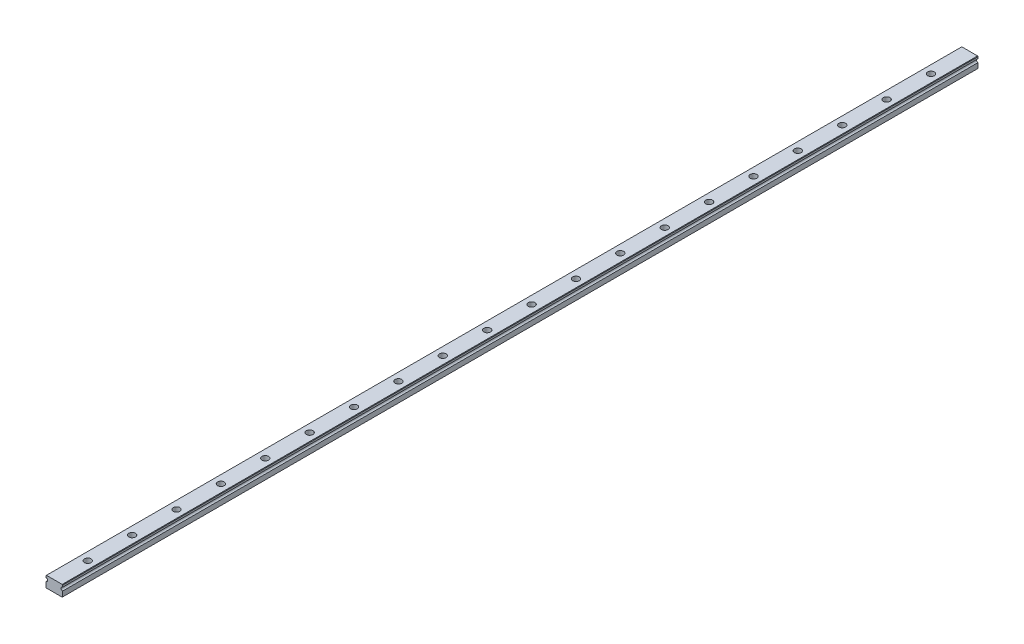
from build123d import *

# Parameters (mm, degrees)
EXTRUDE_1_DEPTH        = 1000
SKETCH_2_R             = 1.5
CUT_EXTRUDE_1_DEPTH    = 20
SKETCH_3_R             = 3
CUT_EXTRUDE_2_DEPTH    = 4.5
PATTERN_LINEAR_1_COUNT = 25
PATTERN_LINEAR_1_PITCH = 40
CUT_EXTRUDE_4_DEPTH    = 80
CUT_EXTRUDE_5_DEPTH    = 80
EXTRUDE_START          = 15
EXTRUDE_2_DEPTH        = 15
CUT_EXTRUDE_START      = -30
CUT_EXTRUDE_8_DEPTH    = 30


with BuildPart() as part:
    # 草图1 → 凸台-拉伸1 (new body)
    with BuildSketch(Plane.XY):
        with BuildLine():
            Line((-7.643186957, 0.234233912), (-7.643186957, -4.365766088))
            Line((-7.643186957, -4.365766088), (-7.243186957, -4.765766088))
            Line((-7.243186957, -4.765766088), (6.956813043, -4.765766088))
            Line((6.956813043, -4.765766088), (7.356813043, -4.365766088))
            Line((7.356813043, -4.365766088), (7.356813043, 0.234233912))
            ThreePointArc((7.356813043, 0.234233912), (6.296152871, 0.67357374), (5.856813043, 1.734233912))
            ThreePointArc((5.856813043, 1.734233912), (6.296152871, 2.794894084), (7.356813043, 3.234233912))
            Line((7.356813043, 3.234233912), (7.356813043, 4.834233912))
            Line((7.356813043, 4.834233912), (6.956813043, 5.234233912))
            Line((6.956813043, 5.234233912), (-7.243186957, 5.234233912))
            Line((-7.243186957, 5.234233912), (-7.643186957, 4.834233912))
            Line((-7.643186957, 4.834233912), (-7.643186957, 3.234233912))
            ThreePointArc((-7.643186957, 3.234233912), (-6.143186957, 1.734233912), (-7.643186957, 0.234233912))
        make_face()
    extrude(amount=EXTRUDE_1_DEPTH)

    # 草图2 → 切除-拉伸1 (cut)
    with BuildSketch(Plane(origin=(0, 5.234233912, 0), x_dir=(1, 0, 0), z_dir=(0, 1, 0))):
        with Locations(Location((0, -20, 0), (0, 0, 270))):
            Circle(SKETCH_2_R)
    cut_extrude_1 = extrude(amount=-CUT_EXTRUDE_1_DEPTH, mode=Mode.SUBTRACT)

    # 草图3 → 切除-拉伸2 (cut)
    with BuildSketch(Plane(origin=(0, 5.234233912, 0), x_dir=(1, 0, 0), z_dir=(0, 1, 0))):
        with Locations(Location((0, -20, 0), (0, 0, 270))):
            Circle(SKETCH_3_R)
    cut_extrude_2 = extrude(amount=-CUT_EXTRUDE_2_DEPTH, mode=Mode.SUBTRACT)

    # 阵列(线性)1: 切除-拉伸1, 切除-拉伸2 ×25
    with Locations(*[(0, 0, i * PATTERN_LINEAR_1_PITCH) for i in range(1, PATTERN_LINEAR_1_COUNT)]):
        add(cut_extrude_1, mode=Mode.SUBTRACT)
        add(cut_extrude_2, mode=Mode.SUBTRACT)

    # 草图6 → 切除-拉伸4 (cut)
    with BuildSketch(Plane(origin=(0, 0, 0), x_dir=(-1, 0, 0), z_dir=(0, 0, -1))):
        with BuildLine():
            Line((7.643186957, 3.234233912), (7.643186957, 4.834233912))
            Line((7.643186957, 4.834233912), (7.243186957, 5.234233912))
            Line((7.243186957, 5.234233912), (-6.956813043, 5.234233912))
            Line((-6.956813043, 5.234233912), (-7.356813043, 4.834233912))
            Line((-7.356813043, 4.834233912), (-7.356813043, 3.234233912))
            ThreePointArc((-7.356813043, 3.234233912), (-5.856813043, 1.734233912), (-7.356813043, 0.234233912))
            Line((-7.356813043, 0.234233912), (-7.356813043, -4.365766088))
            Line((-7.356813043, -4.365766088), (-6.956813043, -4.765766088))
            Line((-6.956813043, -4.765766088), (7.243186957, -4.765766088))
            Line((7.243186957, -4.765766088), (7.643186957, -4.365766088))
            Line((7.643186957, -4.365766088), (7.643186957, 0.234233912))
            ThreePointArc((7.643186957, 0.234233912), (6.143186957, 1.734233912), (7.643186957, 3.234233912))
        make_face()
    extrude(amount=-CUT_EXTRUDE_4_DEPTH, mode=Mode.SUBTRACT)

    # 草图7 → 切除-拉伸5 (cut)
    with BuildSketch(Plane(origin=(0, 0, 80), x_dir=(-1, 0, 0), z_dir=(0, 0, -1))):
        with BuildLine():
            Line((7.643186957, 3.234233912), (7.643186957, 4.834233912))
            Line((7.643186957, 4.834233912), (7.243186957, 5.234233912))
            Line((7.243186957, 5.234233912), (-6.956813043, 5.234233912))
            Line((-6.956813043, 5.234233912), (-7.356813043, 4.834233912))
            Line((-7.356813043, 4.834233912), (-7.356813043, 3.234233912))
            ThreePointArc((-7.356813043, 3.234233912), (-5.856813043, 1.734233912), (-7.356813043, 0.234233912))
            Line((-7.356813043, 0.234233912), (-7.356813043, -4.365766088))
            Line((-7.356813043, -4.365766088), (-6.956813043, -4.765766088))
            Line((-6.956813043, -4.765766088), (7.243186957, -4.765766088))
            Line((7.243186957, -4.765766088), (7.643186957, -4.365766088))
            Line((7.643186957, -4.365766088), (7.643186957, 0.234233912))
            ThreePointArc((7.643186957, 0.234233912), (6.143186957, 1.734233912), (7.643186957, 3.234233912))
        make_face()
    extrude(amount=-CUT_EXTRUDE_5_DEPTH, mode=Mode.SUBTRACT)

    # 草图10 → 凸台-拉伸2 (add)
    with BuildSketch(Plane(origin=(0, 0, 160), x_dir=(-1, 0, 0), z_dir=(0, 0, -1)).offset(EXTRUDE_START)):
        with BuildLine():
            Line((7.643186957, 3.234233912), (7.643186957, 4.834233912))
            Line((7.643186957, 4.834233912), (7.243186957, 5.234233912))
            Line((7.243186957, 5.234233912), (-6.956813043, 5.234233912))
            Line((-6.956813043, 5.234233912), (-7.356813043, 4.834233912))
            Line((-7.356813043, 4.834233912), (-7.356813043, 3.234233912))
            ThreePointArc((-7.356813043, 3.234233912), (-5.856813043, 1.734233912), (-7.356813043, 0.234233912))
            Line((-7.356813043, 0.234233912), (-7.356813043, -4.365766088))
            Line((-7.356813043, -4.365766088), (-6.956813043, -4.765766088))
            Line((-6.956813043, -4.765766088), (7.243186957, -4.765766088))
            Line((7.243186957, -4.765766088), (7.643186957, -4.365766088))
            Line((7.643186957, -4.365766088), (7.643186957, 0.234233912))
            ThreePointArc((7.643186957, 0.234233912), (6.143186957, 1.734233912), (7.643186957, 3.234233912))
        make_face()
    extrude(amount=-EXTRUDE_2_DEPTH)

    # 草图11 → 切除-拉伸8 (cut)
    with BuildSketch(Plane.XY.offset(1000).offset(CUT_EXTRUDE_START)):
        with BuildLine():
            Line((-7.643186957, 0.234233912), (-7.643186957, -4.365766088))
            Line((-7.643186957, -4.365766088), (-7.243186957, -4.765766088))
            Line((-7.243186957, -4.765766088), (6.956813043, -4.765766088))
            Line((6.956813043, -4.765766088), (7.356813043, -4.365766088))
            Line((7.356813043, -4.365766088), (7.356813043, 0.234233912))
            ThreePointArc((7.356813043, 0.234233912), (5.856813043, 1.734233912), (7.356813043, 3.234233912))
            Line((7.356813043, 3.234233912), (7.356813043, 4.834233912))
            Line((7.356813043, 4.834233912), (6.956813043, 5.234233912))
            Line((6.956813043, 5.234233912), (-7.243186957, 5.234233912))
            Line((-7.243186957, 5.234233912), (-7.643186957, 4.834233912))
            Line((-7.643186957, 4.834233912), (-7.643186957, 3.234233912))
            ThreePointArc((-7.643186957, 3.234233912), (-6.143186957, 1.734233912), (-7.643186957, 0.234233912))
        make_face()
    extrude(amount=CUT_EXTRUDE_8_DEPTH, mode=Mode.SUBTRACT)


solid = part.part
